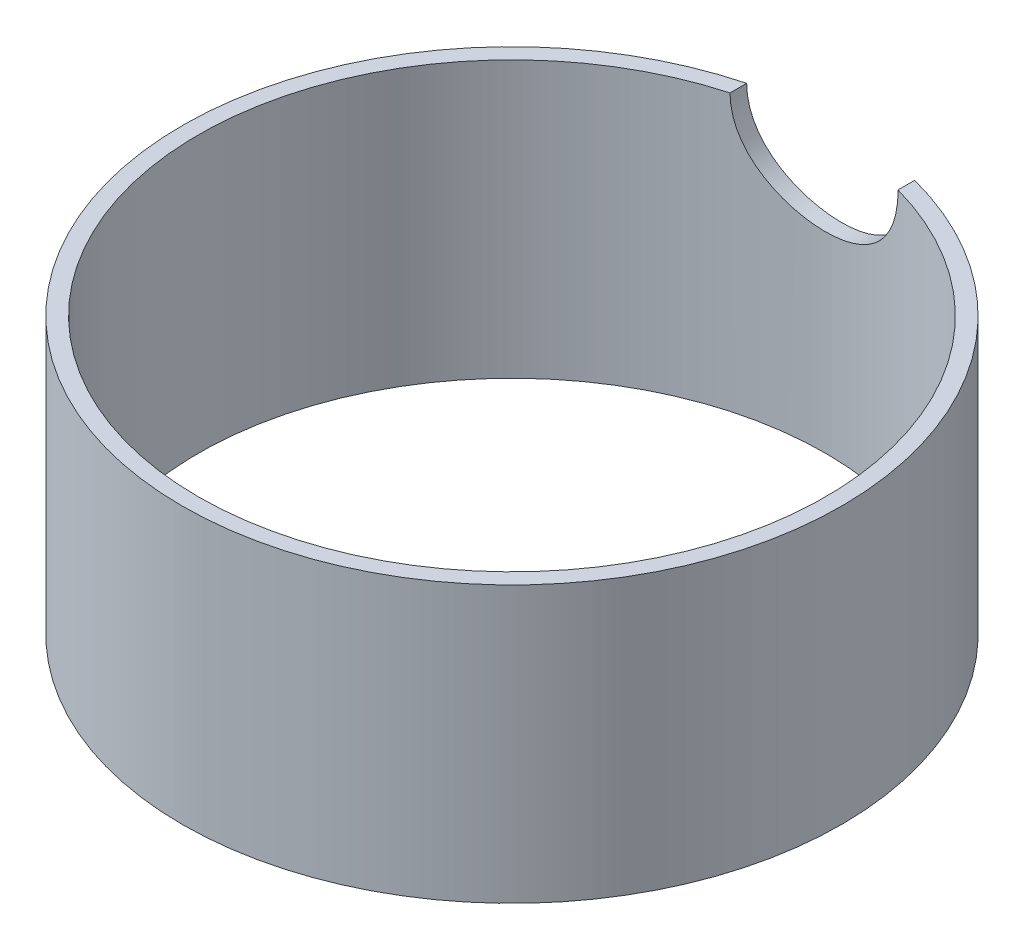
from build123d import *

# Parameters (mm, degrees)
SKETCH1_R           = 41
SKETCH1_R_2         = 39
BOSS_EXTRUDE1_DEPTH = 34.3
SKETCH2_R           = 10.45
CUT_EXTRUDE1_DEPTH  = 68.368315995


with BuildPart() as part:
    # Sketch1 → Boss-Extrude1 (new body)
    with BuildSketch(Plane(origin=(0, 0, 0), x_dir=(1, 0, 0), z_dir=(0, 1, 0))):
        with Locations(Location((0, 0, 0), (0, 0, 270))):
            Circle(SKETCH1_R)
        with Locations(Location((0, 0, 0), (0, 0, 270))):
            Circle(SKETCH1_R_2, mode=Mode.SUBTRACT)
    extrude(amount=BOSS_EXTRUDE1_DEPTH)

    # Sketch2 → Cut-Extrude1 (cut, through all)
    with BuildSketch(Plane.XY):
        with Locations((0, 34.3)):
            Circle(SKETCH2_R)
    extrude(amount=-CUT_EXTRUDE1_DEPTH, mode=Mode.SUBTRACT)


solid = part.part
